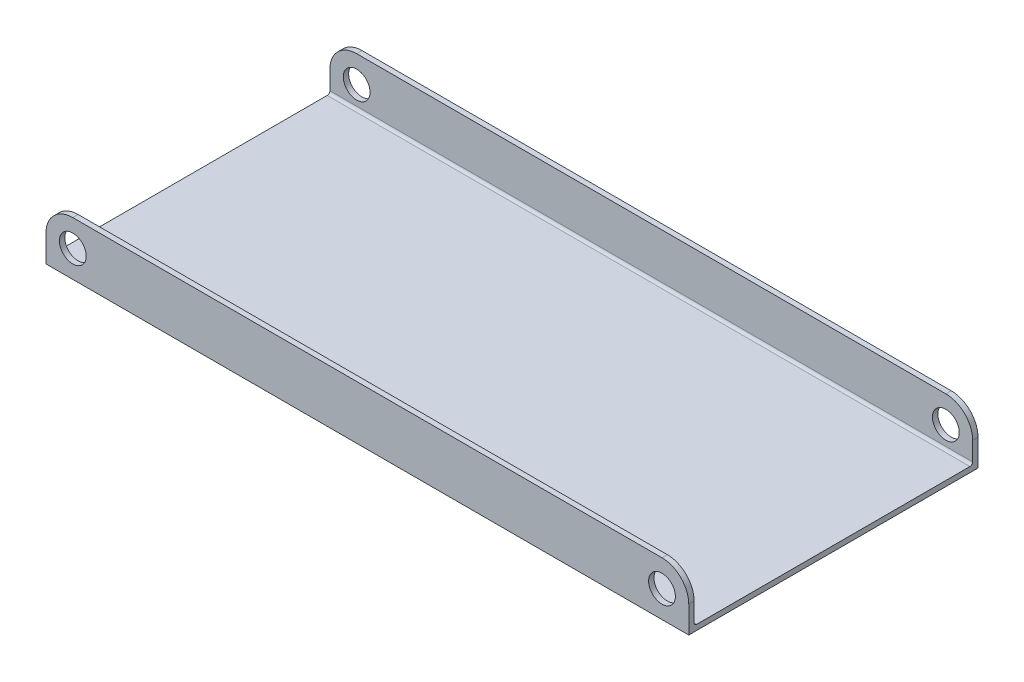
from build123d import *

# Parameters (mm, degrees)
SKETCH2_W           = 152.4
SKETCH2_H           = 68.58
BOSS_EXTRUDE1_DEPTH = 12.7
SKETCH3_W           = 152.4
SKETCH3_H           = 66.04
CUT_EXTRUDE1_DEPTH  = 11.43
SKETCH4_R           = 3.175
CUT_EXTRUDE2_DEPTH  = 104.300272991
FILLET1_R           = 0.635


with BuildPart() as part:
    # Sketch2 → Boss-Extrude1 (new body)
    with BuildSketch(Plane(origin=(0, 0, 0), x_dir=(1, 0, 0), z_dir=(0, 1, 0))):
        Rectangle(SKETCH2_W, SKETCH2_H)
    extrude(amount=BOSS_EXTRUDE1_DEPTH)

    # Sketch3 → Cut-Extrude1 (cut)
    with BuildSketch(Plane(origin=(0, 12.7, 0), x_dir=(1, 0, 0), z_dir=(0, 1, 0))):
        Rectangle(SKETCH3_W, SKETCH3_H)
    extrude(amount=-CUT_EXTRUDE1_DEPTH, mode=Mode.SUBTRACT)

    # Sketch4 → Cut-Extrude2 (cut, through all)
    with BuildSketch(Plane.XY.offset(34.29)):
        with BuildLine():
            Line((-76.2, 12.7), (-76.2, 6.35))
            ThreePointArc((-76.2, 6.35), (-74.340128061, 10.840128061), (-69.85, 12.7))
            Line((-69.85, 12.7), (-76.2, 12.7))
        make_face()
        with Locations((-69.85, 6.35)):
            Circle(SKETCH4_R)
        with Locations((69.85, 6.35)):
            Circle(SKETCH4_R)
        with BuildLine():
            Line((76.2, 12.7), (69.85, 12.7))
            ThreePointArc((69.85, 12.7), (74.340128061, 10.840128061), (76.2, 6.35))
            Line((76.2, 6.35), (76.2, 12.7))
        make_face()
    extrude(amount=-CUT_EXTRUDE2_DEPTH, mode=Mode.SUBTRACT)

    # Fillet1
    fillet1_edges = [part.edges().sort_by_distance(p)[0] for p in [
        (0, 1.27, 33.02),
        (0, 1.27, -33.02),
    ]]
    fillet(fillet1_edges, radius=FILLET1_R)


solid = part.part
